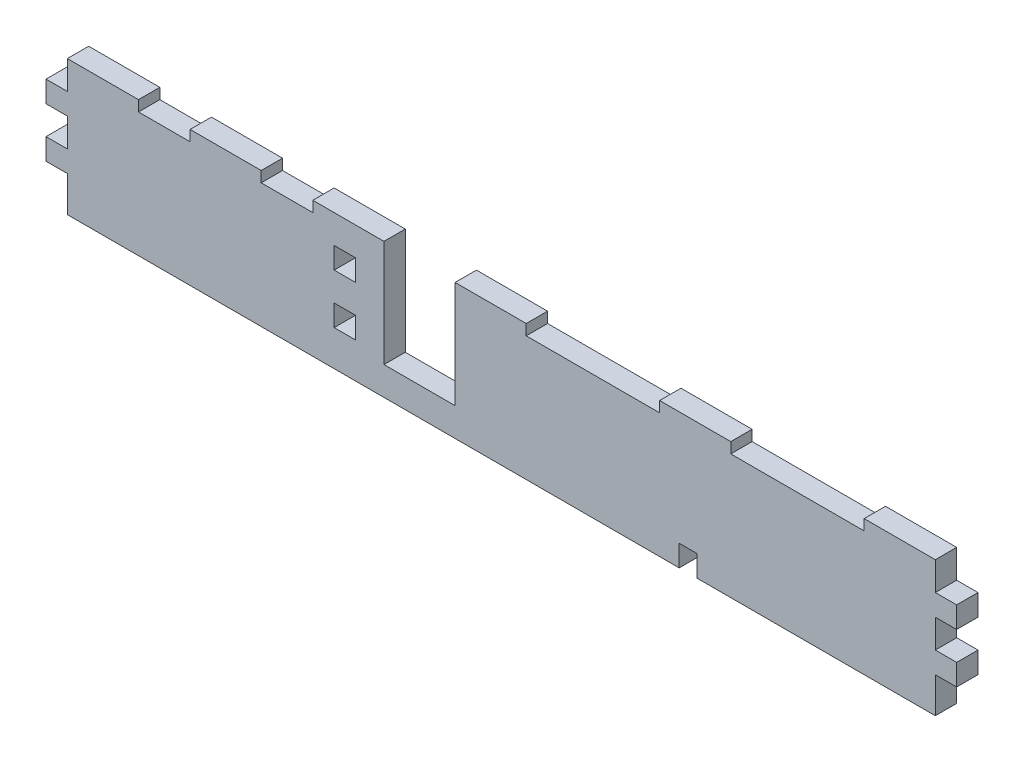
from build123d import *

# Parameters (mm, degrees)
SKETCH_2_W      = 6
SKETCH_2_H      = 6
EXTRUDE_1_DEPTH = 6


with BuildPart() as part:
    # Эскиз2 → Бобышка-Вытянуть1 (new body)
    with BuildSketch(Plane.XY):
        Polygon((89, 38), (89, 8), (109, 8), (109, 38), (129, 38), (129, 35), (166.5, 35), (166.5, 38), (186.5, 38), (186.5, 35), (224, 35), (224, 38), (244, 38), (244, 30), (250, 30), (250, 24), (244, 24), (244, 16), (250, 16), (250, 10), (244, 10), (244, 0), (177, 0), (177, 6), (172, 6), (172, 0), (0, 0), (0, 10), (-6, 10), (-6, 16), (0, 16), (0, 24), (-6, 24), (-6, 30), (0, 30), (0, 38), (20, 38), (20, 35), (34.5, 35), (34.5, 38), (54.5, 38), (54.5, 35), (69, 35), (69, 38), align=None)
        with Locations((78, 27)):
            Rectangle(SKETCH_2_W, SKETCH_2_H, mode=Mode.SUBTRACT)
        with Locations((78, 13)):
            Rectangle(SKETCH_2_W, SKETCH_2_H, mode=Mode.SUBTRACT)
    extrude(amount=EXTRUDE_1_DEPTH)


solid = part.part
